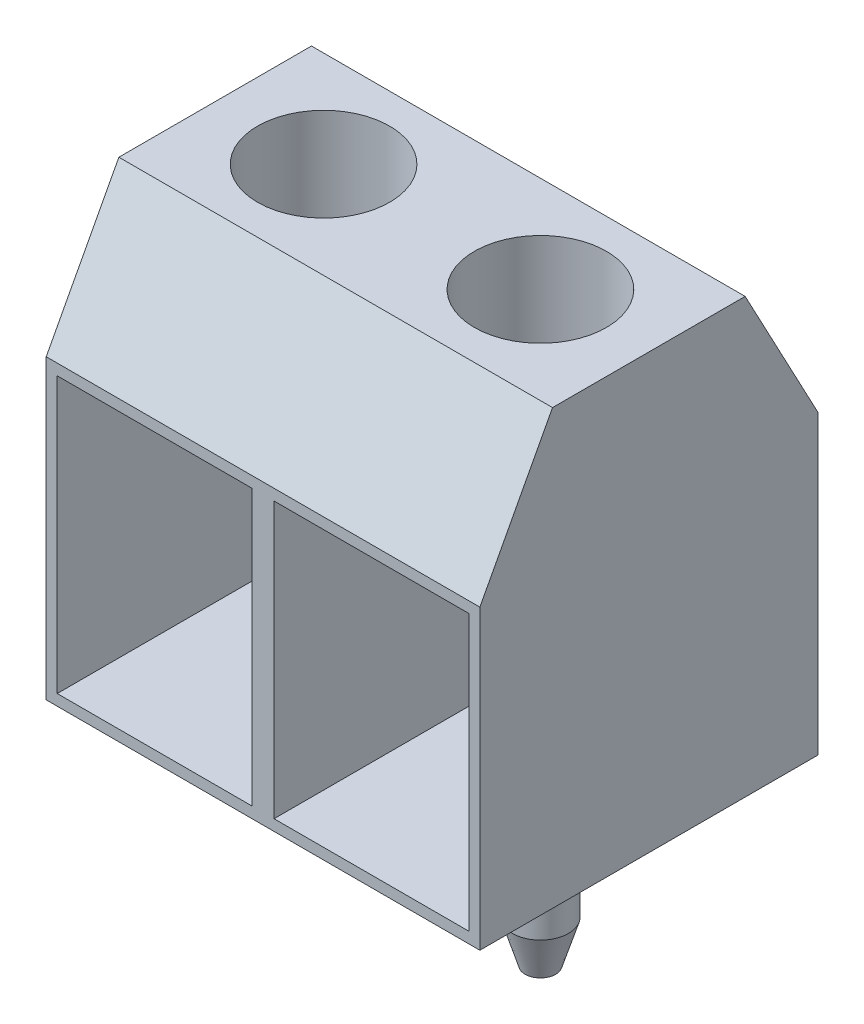
from build123d import *

# Parameters (mm, degrees)
SKETCH3_W                     = 10.0076
SKETCH3_H                     = 7.7978
BOSS_EXTRUDE1_DEPTH           = 10.0076
CUT_EXTRUDE1_DEPTH            = 10.0076
SKETCH5_R                     = 1.524
CUT_EXTRUDE2_DEPTH            = 2.54
SKETCH6_W                     = 4.4958
SKETCH6_H                     = 6.35
CUT_EXTRUDE3_DEPTH            = 5.08
SKETCH8_R                     = 0.6477
BOSS_EXTRUDE2_DEPTH           = 2.54
SKETCH9_R                     = 0.6477
BOSS_EXTRUDE3_DEPTH           = 0.9652
BOSS_EXTRUDE3_DRAFT           = 17
BOSS_EXTRUDE3_PROFILE_2_DEPTH = 0.9652
BOSS_EXTRUDE3_PROFILE_2_DRAFT = 17


with BuildPart() as part:
    # Sketch3 → Boss-Extrude1 (new body)
    with BuildSketch(Plane(origin=(0, 0, 0), x_dir=(1, 0, 0), z_dir=(0, 1, 0))):
        Rectangle(SKETCH3_W, SKETCH3_H)
    extrude(amount=BOSS_EXTRUDE1_DEPTH)

    # Sketch4 → Cut-Extrude1 (cut)
    with BuildSketch(Plane.ZY.offset(5.0038)):
        Polygon((-3.8989, 10.0076), (-3.8989, 6.858), (-2.2225, 10.0076), align=None)
        Polygon((3.8989, 10.0076), (2.2225, 10.0076), (3.8989, 6.858), align=None)
    extrude(amount=-CUT_EXTRUDE1_DEPTH, mode=Mode.SUBTRACT)

    # Sketch5 → Cut-Extrude2 (cut)
    with BuildSketch(Plane(origin=(0, 10.0076, 0), x_dir=(1, 0, 0), z_dir=(0, 1, 0))):
        with Locations(Location((-2.5019, 0, 0), (0, 0, 270))):
            Circle(SKETCH5_R)
        with Locations(Location((2.5019, 0, 0), (0, 0, 270))):
            Circle(SKETCH5_R)
    extrude(amount=-CUT_EXTRUDE2_DEPTH, mode=Mode.SUBTRACT)

    # Sketch6 → Cut-Extrude3 (cut)
    with BuildSketch(Plane.XY.offset(3.8989)):
        with Locations((-2.5019, 3.429)):
            Rectangle(SKETCH6_W, SKETCH6_H)
        with Locations((2.5019, 3.429)):
            Rectangle(SKETCH6_W, SKETCH6_H)
    extrude(amount=-CUT_EXTRUDE3_DEPTH, mode=Mode.SUBTRACT)

    # Sketch8 → Boss-Extrude2 (add)
    with BuildSketch(Plane.XZ):
        with Locations(Location((-2.5019, 0, 0), (0, 0, 270))):
            Circle(SKETCH8_R)
        with Locations(Location((2.5019, 0, 0), (0, 0, 270))):
            Circle(SKETCH8_R)
    extrude(amount=BOSS_EXTRUDE2_DEPTH)


with BuildPart() as boss_extrude3_tool:
    # Sketch9 → Boss-Extrude3 (with draft: the straight prism first)
    with BuildSketch(Plane.XZ.offset(2.54)):
        with Locations(Location((2.5019, 0, 0), (0, 0, 270))):
            Circle(SKETCH9_R)
    extrude(amount=BOSS_EXTRUDE3_DEPTH)
    # Boss-Extrude3: the draft: its side faces are tilted about the plane it starts from
    boss_extrude3_sides = [boss_extrude3_tool.faces().sort_by_distance(p)[0] for p in [
        (2.5019, -3.0226, 0.6477),
    ]]
    draft(boss_extrude3_sides, Plane.XZ.offset(2.54), BOSS_EXTRUDE3_DRAFT)


with BuildPart() as part_1:
    add(part.part)

    # Boss-Extrude3: add boss_extrude3_tool
    add(boss_extrude3_tool.part)


with BuildPart() as boss_extrude3_profile_2_tool:
    # Sketch9 → Boss-Extrude3 profile 2 (with draft: the straight prism first)
    with BuildSketch(Plane.XZ.offset(2.54)):
        with Locations(Location((-2.5019, 0, 0), (0, 0, 270))):
            Circle(SKETCH9_R)
    extrude(amount=BOSS_EXTRUDE3_PROFILE_2_DEPTH)
    # Boss-Extrude3 profile 2: the draft: its side faces are tilted about the plane it starts from
    boss_extrude3_profile_2_sides = [boss_extrude3_profile_2_tool.faces().sort_by_distance(p)[0] for p in [
        (-2.5019, -3.0226, 0.6477),
    ]]
    draft(boss_extrude3_profile_2_sides, Plane.XZ.offset(2.54), BOSS_EXTRUDE3_PROFILE_2_DRAFT)


with BuildPart() as part_2:
    add(part_1.part)

    # Boss-Extrude3 profile 2: add boss_extrude3_profile_2_tool
    add(boss_extrude3_profile_2_tool.part)


solid = part_2.part
